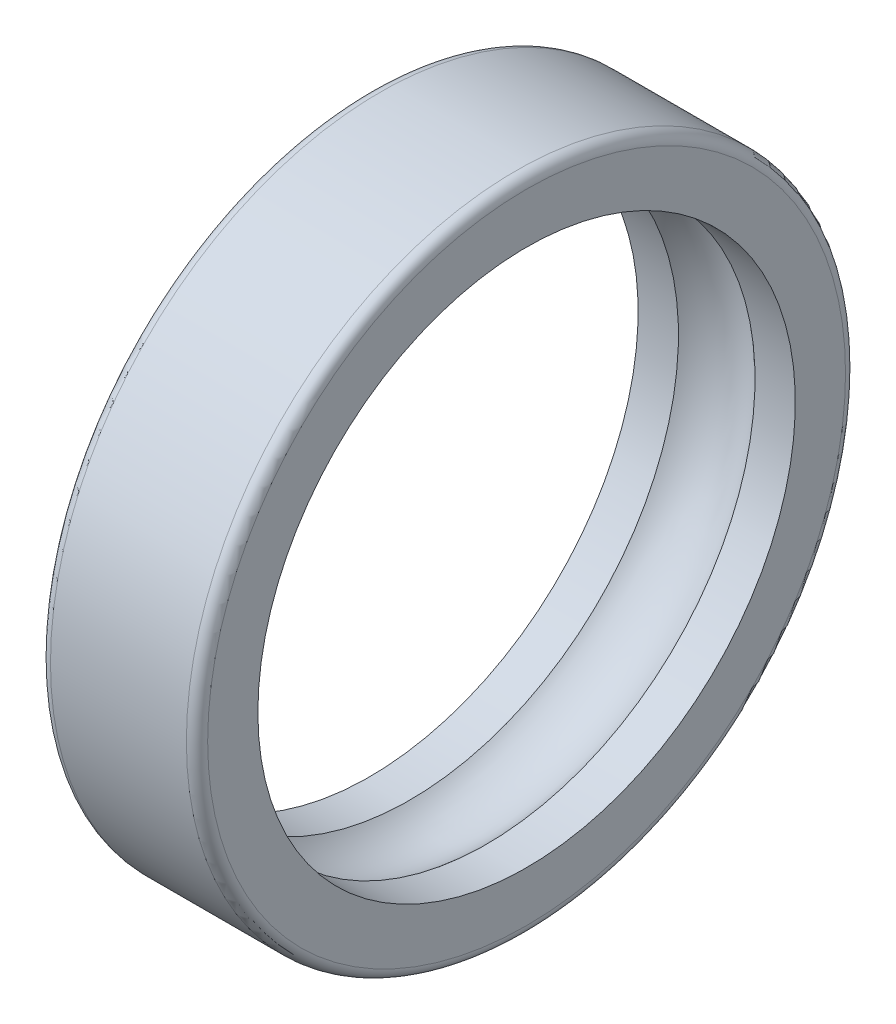
from build123d import *

# Parameters (mm, degrees)
FILLET2_R = 2.1


with BuildPart() as part:
    # Sketch1 → Revolve1 (revolve)
    with BuildSketch(Plane(origin=(0, 0, 0), x_dir=(1, 0, 0), z_dir=(0, 1, 0)), mode=Mode.PRIVATE) as revolve1_sk:
        with BuildLine():
            Line((152.17858106, 53), (144.228415495, 53))
            ThreePointArc((144.228415495, 53), (136.67858106, 56), (129.128746624, 53))
            Line((129.128746624, 53), (121.17858106, 53))
            Line((121.17858106, 53), (121.17858106, 65))
            Line((121.17858106, 65), (152.17858106, 65))
            Line((152.17858106, 65), (152.17858106, 53))
        make_face()
    revolve(revolve1_sk.sketch.rotate(Axis((-165.426008969, 0, 0), (1, 0, 0)), 180), axis=Axis((-165.426008969, 0, 0), (1, 0, 0)))

    # Fillet2
    fillet2_edges = [part.edges().sort_by_distance(p)[0] for p in [
        (152.17858106, 0, -65),
        (121.17858106, 0, -65),
    ]]
    fillet(fillet2_edges, radius=FILLET2_R)


solid = part.part
